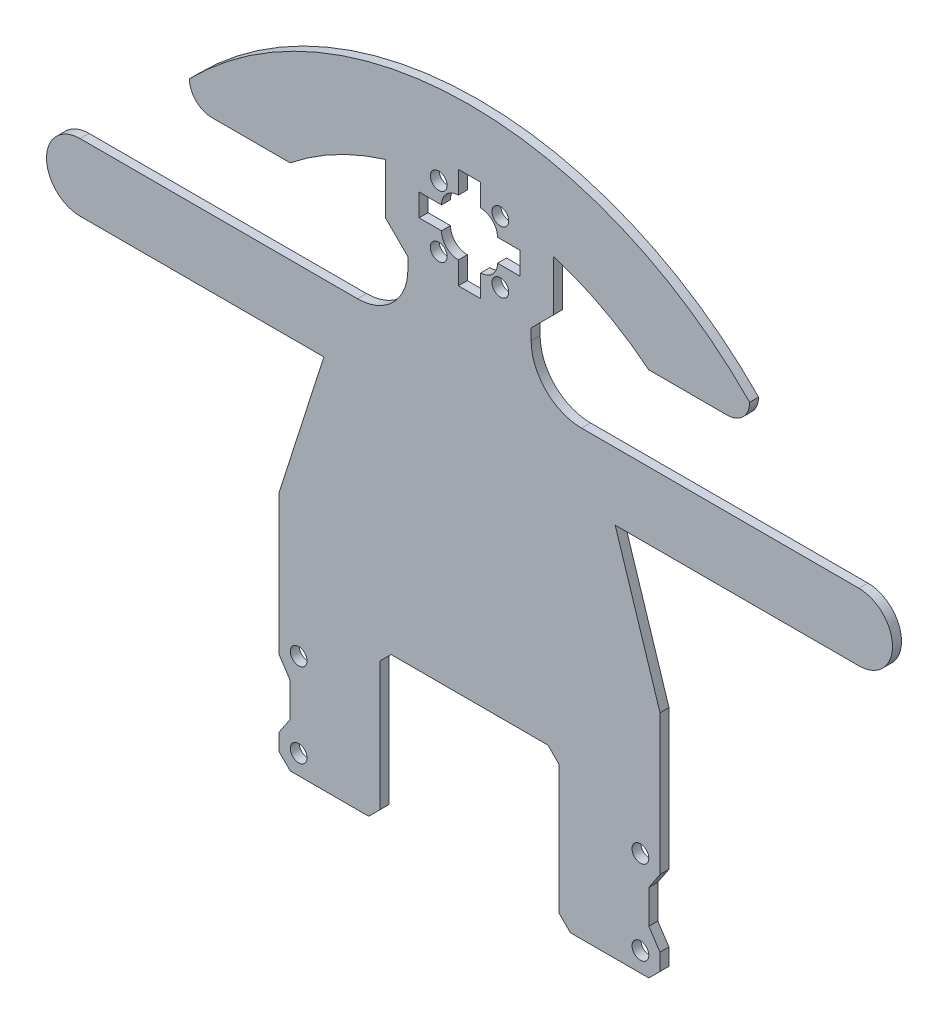
from build123d import *

# Parameters (mm, degrees)
RESSALTO_EXTRUS_O1_DEPTH = 1.6
ESBO_O2_R                = 1.5
CORTE_EXTRUS_O2_DEPTH    = 2
ESBO_O3_R                = 1.5
CORTE_EXTRUS_O3_DEPTH    = 10
ESBO_O4_R                = 1.5
CORTE_EXTRUS_O4_DEPTH    = 10


with BuildPart() as part:
    # Esboço1 → Ressalto-extrusão1 (new body)
    with BuildSketch(Plane.XY):
        with BuildLine():
            Line((14, 0), (-14, 0))
            Line((-14, 0), (-16, -2))
            Line((-16, -2), (-16, -25))
            Line((-16, -25), (-18, -27))
            Line((-18, -27), (-32, -27))
            Line((-32, -27), (-34, -25))
            Line((-34, -25), (-34, -22))
            Line((-34, -22), (-32, -19))
            Line((-32, -19), (-32, -13))
            Line((-32, -13), (-34, -10))
            Line((-34, -10), (-34, 15))
            Line((-34, 15), (-26, 40))
            Line((-26, 40), (-69.5, 40))
            ThreePointArc((-69.5, 40), (-75.5, 46), (-69.5, 52))
            Line((-69.5, 52), (-20, 52))
            ThreePointArc((-20, 52), (-13.636038969, 54.636038969), (-11, 61))
            Line((-11, 61), (-11, 63))
            Line((-11, 63), (-15, 67))
            Line((-15, 67), (-15, 76))
            Line((-15, 76), (-15.107398643, 76))
            ThreePointArc((-15.107398643, 76), (-23.979715422, 72.299613351), (-32, 67))
            Line((-32, 67), (-46, 67))
            ThreePointArc((-46, 67), (-48.828427125, 68.171572875), (-50, 71))
            ThreePointArc((-50, 71), (0, 92), (50, 71))
            ThreePointArc((50, 71), (48.828427125, 68.171572875), (46, 67))
            Line((46, 67), (32, 67))
            ThreePointArc((32, 67), (23.979715422, 72.299613351), (15.107398643, 76))
            Line((15.107398643, 76), (15, 76))
            Line((15, 76), (15, 67))
            Line((15, 67), (11, 63))
            Line((11, 63), (11, 61))
            ThreePointArc((11, 61), (13.636038969, 54.636038969), (20, 52))
            Line((20, 52), (69.5, 52))
            ThreePointArc((69.5, 52), (75.5, 46), (69.5, 40))
            Line((69.5, 40), (26, 40))
            Line((26, 40), (34, 15))
            Line((34, 15), (34, -10))
            Line((34, -10), (32, -13))
            Line((32, -13), (32, -19))
            Line((32, -19), (34, -22))
            Line((34, -22), (34, -25))
            Line((34, -25), (32, -27))
            Line((32, -27), (18, -27))
            Line((18, -27), (16, -25))
            Line((16, -25), (16, -2))
            Line((16, -2), (14, 0))
        make_face()
    extrude(amount=RESSALTO_EXTRUS_O1_DEPTH)

    # Esboço2 → Corte-extrusão2 (cut)
    with BuildSketch(Plane(origin=(0, 0, 0), x_dir=(-1, 0, 0), z_dir=(0, 0, -1))):
        with Locations((5.5, 66.5)):
            Circle(ESBO_O2_R)
        with Locations((-5.5, 66.5)):
            Circle(ESBO_O2_R)
        with Locations((-5.5, 77.5)):
            Circle(ESBO_O2_R)
        with Locations((5.5, 77.5)):
            Circle(ESBO_O2_R)
        with BuildLine():
            Line((-5, 70), (-9, 70))
            Line((-9, 70), (-9, 74))
            Line((-9, 74), (-5, 74))
            ThreePointArc((-5, 74), (-4.121320344, 76.121320344), (-2, 77))
            Line((-2, 77), (-2, 81))
            Line((-2, 81), (2, 81))
            Line((2, 81), (2, 77))
            ThreePointArc((2, 77), (4.121320344, 76.121320344), (5, 74))
            Line((5, 74), (9, 74))
            Line((9, 74), (9, 70))
            Line((9, 70), (5, 70))
            ThreePointArc((5, 70), (4.121320344, 67.878679656), (2, 67))
            Line((2, 67), (2, 63))
            Line((2, 63), (-2, 63))
            Line((-2, 63), (-2, 67))
            ThreePointArc((-2, 67), (-4.121320344, 67.878679656), (-5, 70))
        make_face()
    extrude(amount=-CORTE_EXTRUS_O2_DEPTH, mode=Mode.SUBTRACT)

    # Esboço3 → Corte-extrusão3 (cut)
    with BuildSketch(Plane.XY.offset(1.6)):
        with Locations((-30.5, -23.5)):
            Circle(ESBO_O3_R)
        with Locations((30.5, -23.5)):
            Circle(ESBO_O3_R)
    extrude(amount=-CORTE_EXTRUS_O3_DEPTH, mode=Mode.SUBTRACT)

    # Esboço4 → Corte-extrusão4 (cut)
    with BuildSketch(Plane.XY.offset(1.6)):
        with Locations((-30.5, -8.5)):
            Circle(ESBO_O4_R)
        with Locations((30.5, -8.5)):
            Circle(ESBO_O4_R)
    extrude(amount=-CORTE_EXTRUS_O4_DEPTH, mode=Mode.SUBTRACT)


solid = part.part
